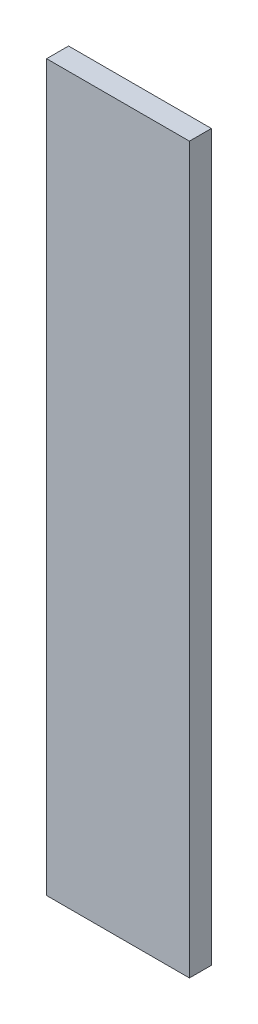
from build123d import *

# Parameters (mm, degrees)
ESQUISSE1_W        = 11.7
ESQUISSE1_H        = 59.37
BOSS_EXTRU_1_DEPTH = 1.8


with BuildPart() as part:
    # Esquisse1 → Boss.-Extru.1 (new body)
    with BuildSketch(Plane.XY):
        Rectangle(ESQUISSE1_W, ESQUISSE1_H)
    extrude(amount=BOSS_EXTRU_1_DEPTH)


solid = part.part
